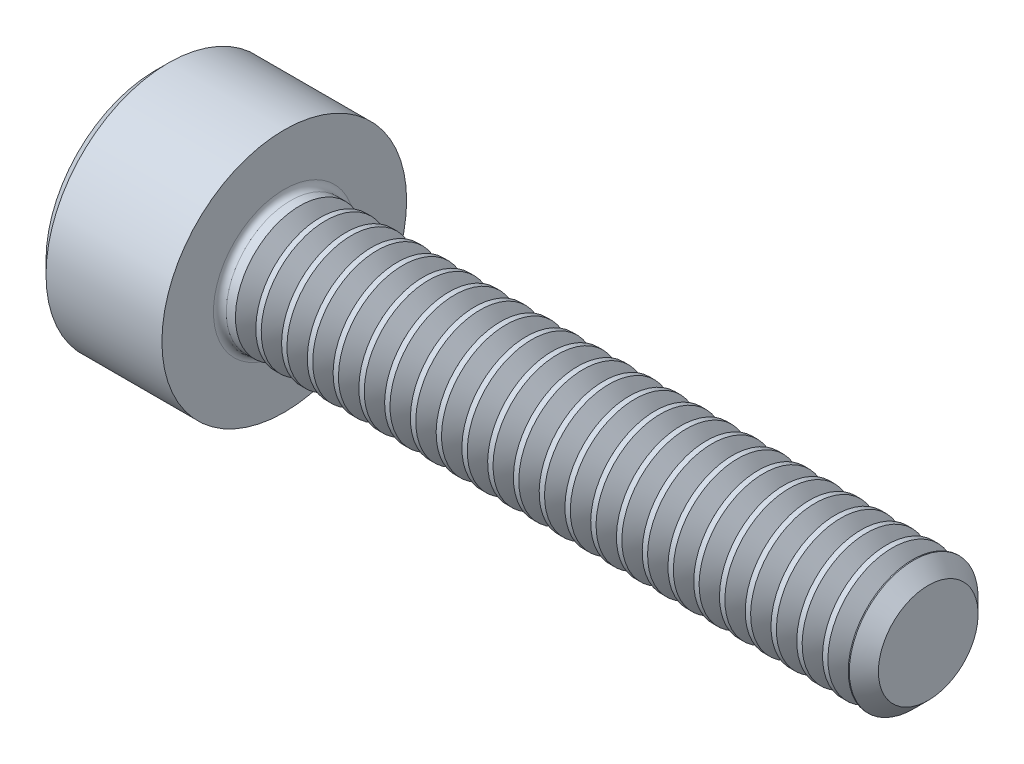
from build123d import *

# Parameters (mm, degrees)
FILLET1_R       = 0.1
HEX_2_DEPTH     = 1
THDSCHPAT_COUNT = 24
THDSCHPAT_PITCH = 0.4


with BuildPart() as part:
    # BodySke → Base-Revolve (revolve)
    with BuildSketch(Plane.XY, mode=Mode.PRIVATE) as base_revolve_sk:
        Polygon((0, 0), (0, 1.7), (0.2, 1.9), (2, 1.9), (2, 1), (11.774, 1), (12, 0.774), (12, 0), align=None)
    revolve(base_revolve_sk.sketch.rotate(Axis((-31.75, 0, 0), (1, 0, 0)), 90), axis=Axis((-31.75, 0, 0), (1, 0, 0)))

    # Fillet1
    fillet1_edges = [part.edges().sort_by_distance(p)[0] for p in [
        (2, 0, -1),
    ]]
    fillet(fillet1_edges, radius=FILLET1_R)

    # Sketch2 → Hex-PreBroach (revolve, cut)
    with BuildSketch(Plane.XY, mode=Mode.PRIVATE) as hex_prebroach_sk:
        Polygon((0, 0.7725), (1, 0.7725), (1.446003083, 0), (0, 0), align=None)
    revolve(hex_prebroach_sk.sketch.rotate(Axis((0, 0, 0), (1, 0, 0)), 90), axis=Axis((0, 0, 0), (1, 0, 0)), mode=Mode.SUBTRACT)

    # Sketch3 → Hex 2 (cut)
    with BuildSketch(Plane(origin=(0, 0, 0), x_dir=(0, 0.500000000000001, 0.866025403784438), z_dir=(-1, 0, 0))):
        Polygon((0.446003083, 0.7725), (-0.446003083, 0.7725), (-0.892006166, 0), (-0.446003083, -0.7725), (0.446003083, -0.7725), (0.892006166, 0), align=None)
    extrude(amount=-HEX_2_DEPTH, mode=Mode.SUBTRACT)

    # ThdSchSke → ThreadSchematic (revolve, cut)
    with BuildSketch(Plane.XY):
        Polygon((2.4, -0.774), (2.241753096, -1), (2.241753096, -1.25), (2.558246904, -1.25), (2.558246904, -1), align=None)
    threadschematic = revolve(axis=Axis((-3.175, 0, 0), (1, 0, 0)), mode=Mode.SUBTRACT)

    # ThdSchPat: ThreadSchematic ×24
    with Locations(*[(i * THDSCHPAT_PITCH, 0, 0) for i in range(1, THDSCHPAT_COUNT)]):
        add(threadschematic, mode=Mode.SUBTRACT)


solid = part.part
